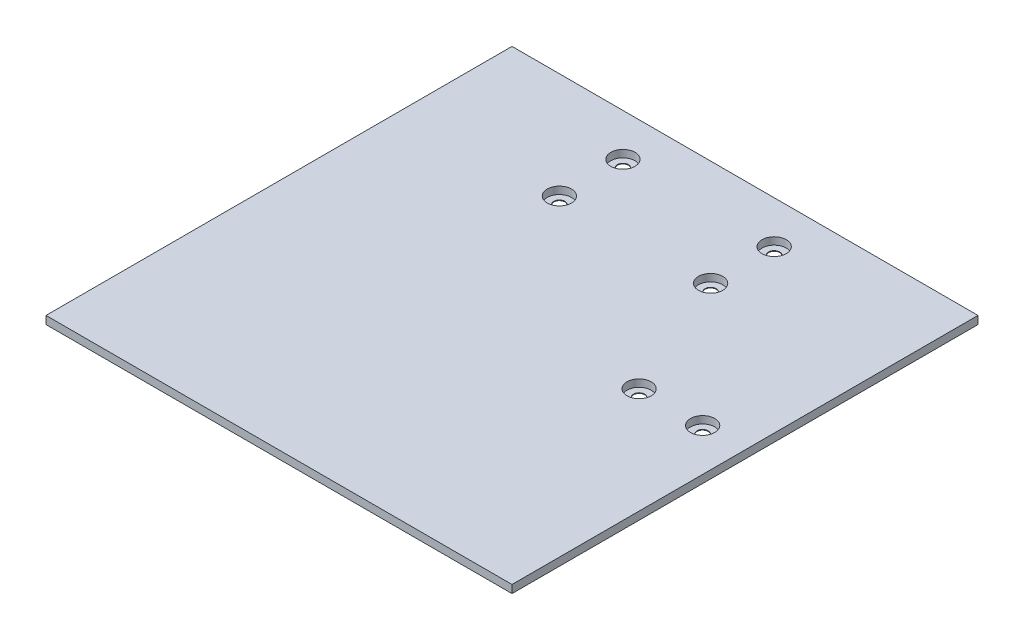
from build123d import *

# Parameters (mm, degrees)
SKETCH1_W                               = 279.4
SKETCH1_H                               = 279.4
BOSS_EXTRUDE1_DEPTH                     = 4.7625
CBORE_FOR_M6_HEX_HEAD_BOLT1_D           = 6.6
CBORE_FOR_M6_HEX_HEAD_BOLT1_CBORE_D     = 14.55
CBORE_FOR_M6_HEX_HEAD_BOLT1_CBORE_DEPTH = 4.38


with BuildPart() as part:
    # Sketch1 → Boss-Extrude1 (new body)
    with BuildSketch(Plane(origin=(0, 0, 0), x_dir=(1, 0, 0), z_dir=(0, 1, 0))):
        Rectangle(SKETCH1_W, SKETCH1_H)
    extrude(amount=BOSS_EXTRUDE1_DEPTH)

    # CBORE for M6 Hex Head Bolt1 (through all)
    with Locations(Plane(origin=(0, 4.7625, 0), x_dir=(1, 0, 0), z_dir=(0, 1, 0))):
        with Locations((-47.792708387, 76.2), (42.882092114, 76.2), (-47.792708387, 114.3), (42.882092114, 114.3), (76.2, 0), (114.3, 0)):
            CounterBoreHole(CBORE_FOR_M6_HEX_HEAD_BOLT1_D / 2, CBORE_FOR_M6_HEX_HEAD_BOLT1_CBORE_D / 2, CBORE_FOR_M6_HEX_HEAD_BOLT1_CBORE_DEPTH)


solid = part.part
